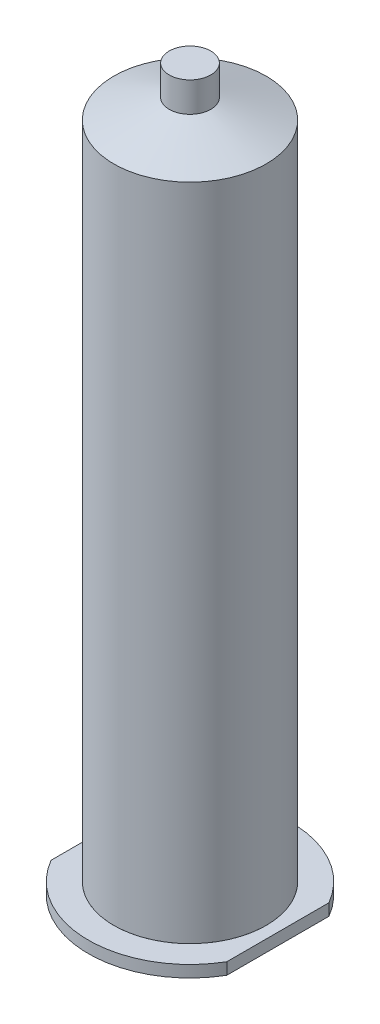
from build123d import *

# Parameters (mm, degrees)
SKETCH1_W           = 17.5
SKETCH1_H           = 151.5
SHELL1_T            = -4
SKETCH2_R           = 17.5
BOSS_EXTRUDE1_DEPTH = 2.7


with BuildPart() as part:
    # Sketch1 → Revolve1 (revolve)
    with BuildSketch(Plane.XY, mode=Mode.PRIVATE) as revolve1_sk:
        Polygon((4.775, 151.5), (4.775, 156), (4.775, 162.85), (0, 162.85), (0, 151.5), align=None)
        with Locations((8.75, 75.75)):
            Rectangle(SKETCH1_W, SKETCH1_H)
        Polygon((17.5, 151.5), (4.775, 156), (4.775, 151.5), align=None)
    revolve(revolve1_sk.sketch.rotate(Axis((0, 0, 0), (0, 1, 0)), 90), axis=Axis((0, 0, 0), (0, 1, 0)))

    # Shell1
    shell1_openings = [part.faces().sort_by_distance(p)[0] for p in [
        (0, 0, 0),
    ]]
    offset(amount=SHELL1_T, openings=shell1_openings, kind=Kind.INTERSECTION)


with BuildPart() as body_2:
    # Sketch2 → Boss-Extrude1 (new body)
    with BuildSketch(Plane.XZ):
        with BuildLine():
            Line((-20.185, 11.738325051), (-20.185, -11.738325051))
            ThreePointArc((-20.185, -11.738325051), (0, -23.35), (20.185, -11.738325051))
            Line((20.185, -11.738325051), (20.185, 11.738325051))
            ThreePointArc((20.185, 11.738325051), (0, 23.35), (-20.185, 11.738325051))
        make_face()
        with Locations(Location((0, 0, 0), (0, 0, 90))):
            Circle(SKETCH2_R, mode=Mode.SUBTRACT)
    extrude(amount=BOSS_EXTRUDE1_DEPTH)


solid = Compound([part.part, body_2.part])
